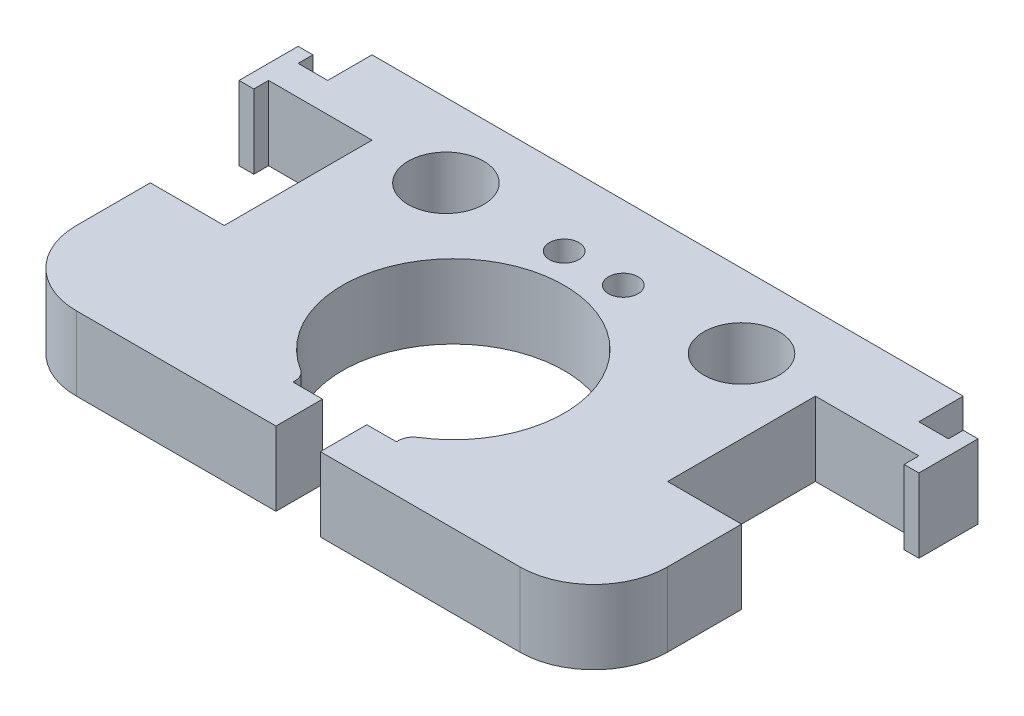
from build123d import *

# Parameters (mm, degrees)
SKETCH_1_R      = 2.55
SKETCH_1_R_2    = 1
EXTRUDE_1_DEPTH = 5


with BuildPart() as part:
    # 草图1 → 凸台-拉伸1 (new body)
    with BuildSketch(Plane(origin=(0, 0, 0), x_dir=(1, 0, 0), z_dir=(0, 1, 0))):
        with BuildLine():
            Line((35, 20), (37, 20))
            Line((37, 20), (37, 19))
            Line((37, 19), (38, 19))
            Line((38, 19), (38, 23))
            Line((38, 23), (37, 23))
            Line((37, 23), (37, 22))
            Line((37, 22), (35, 22))
            Line((35, 22), (35, 25))
            Line((35, 25), (30, 25))
            Line((30, 25), (20, 25))
            Line((20, 25), (10, 25))
            Line((10, 25), (0, 25))
            Line((0, 25), (-5, 25))
            Line((-5, 25), (-5, 22))
            Line((-5, 22), (-7, 22))
            Line((-7, 22), (-7, 23))
            Line((-7, 23), (-8, 23))
            Line((-8, 23), (-8, 19))
            Line((-8, 19), (-7, 19))
            Line((-7, 19), (-7, 20))
            Line((-7, 20), (-5, 20))
            Line((-5, 20), (0, 20))
            Line((0, 20), (0, 10))
            Line((0, 10), (-5, 10))
            Line((-5, 10), (-5, 5))
            ThreePointArc((-5, 5), (-3.535533906, 1.464466094), (0, 0))
            Line((0, 0), (5, 0))
            Line((5, 0), (13.5, 0))
            Line((13.5, 0), (13.5, 3.151530772))
            Line((13.5, 3.151530772), (11.5, 3.151530772))
            Line((11.5, 3.151530772), (11.5, 3.288897449))
            ThreePointArc((11.5, 3.288897449), (11.374474632, 3.773968699), (11.029411765, 4.137262455))
            ThreePointArc((11.029411765, 4.137262455), (15, 18), (18.970588235, 4.137262455))
            ThreePointArc((18.970588235, 4.137262455), (18.625525368, 3.773968699), (18.5, 3.288897449))
            Line((18.5, 3.288897449), (18.5, 3.151530772))
            Line((18.5, 3.151530772), (16.5, 3.151530772))
            Line((16.5, 3.151530772), (16.5, 0))
            Line((16.5, 0), (25, 0))
            Line((25, 0), (30, 0))
            ThreePointArc((30, 0), (33.535533906, 1.464466094), (35, 5))
            Line((35, 5), (35, 10))
            Line((35, 10), (30, 10))
            Line((30, 10), (30, 20))
            Line((30, 20), (35, 20))
        make_face()
        with Locations(Location((5, 20, 0), (0, 0, 270))):
            Circle(SKETCH_1_R, mode=Mode.SUBTRACT)
        with Locations(Location((25, 20, 0), (0, 0, 270))):
            Circle(SKETCH_1_R, mode=Mode.SUBTRACT)
        with Locations(Location((13, 20, 0), (0, 0, 270))):
            Circle(SKETCH_1_R_2, mode=Mode.SUBTRACT)
        with Locations(Location((17, 20, 0), (0, 0, 270))):
            Circle(SKETCH_1_R_2, mode=Mode.SUBTRACT)
    extrude(amount=EXTRUDE_1_DEPTH)


solid = part.part
